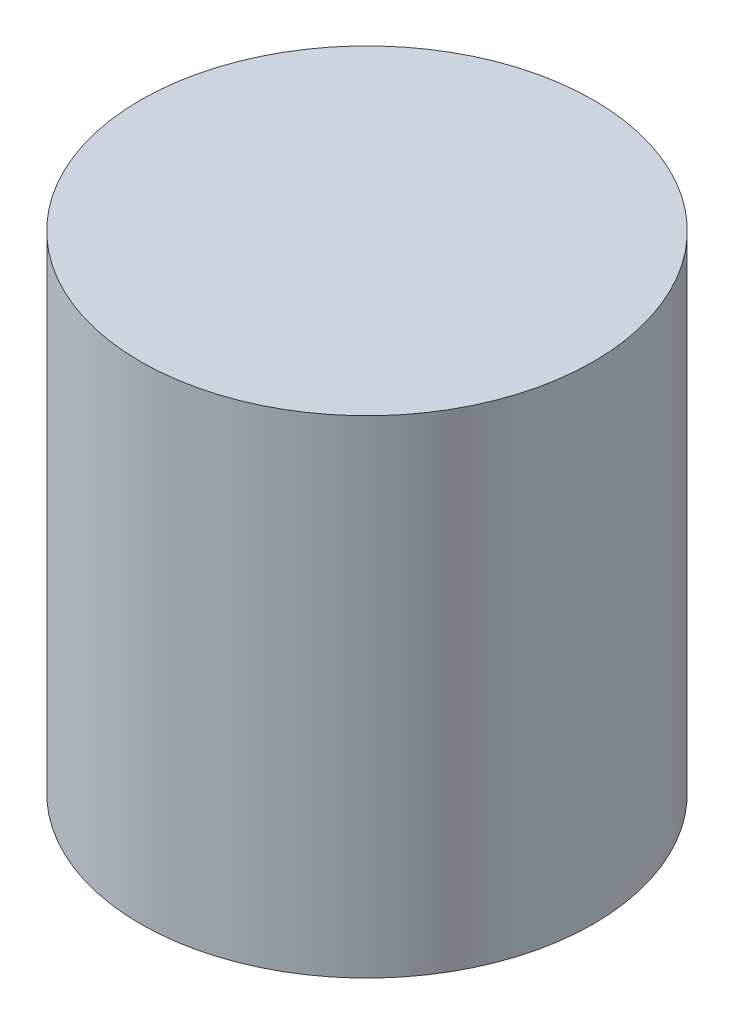
from build123d import *

# Parameters (mm, degrees)
SKETCH1_R           = 10.16
BOSS_EXTRUDE1_DEPTH = 21.844


with BuildPart() as part:
    # Sketch1 → Boss-Extrude1 (new body)
    with BuildSketch(Plane(origin=(0, 0, 0), x_dir=(1, 0, 0), z_dir=(0, 1, 0))):
        with Locations(Location((0, 0, 0), (0, 0, 270))):
            Circle(SKETCH1_R)
    extrude(amount=BOSS_EXTRUDE1_DEPTH)


solid = part.part
